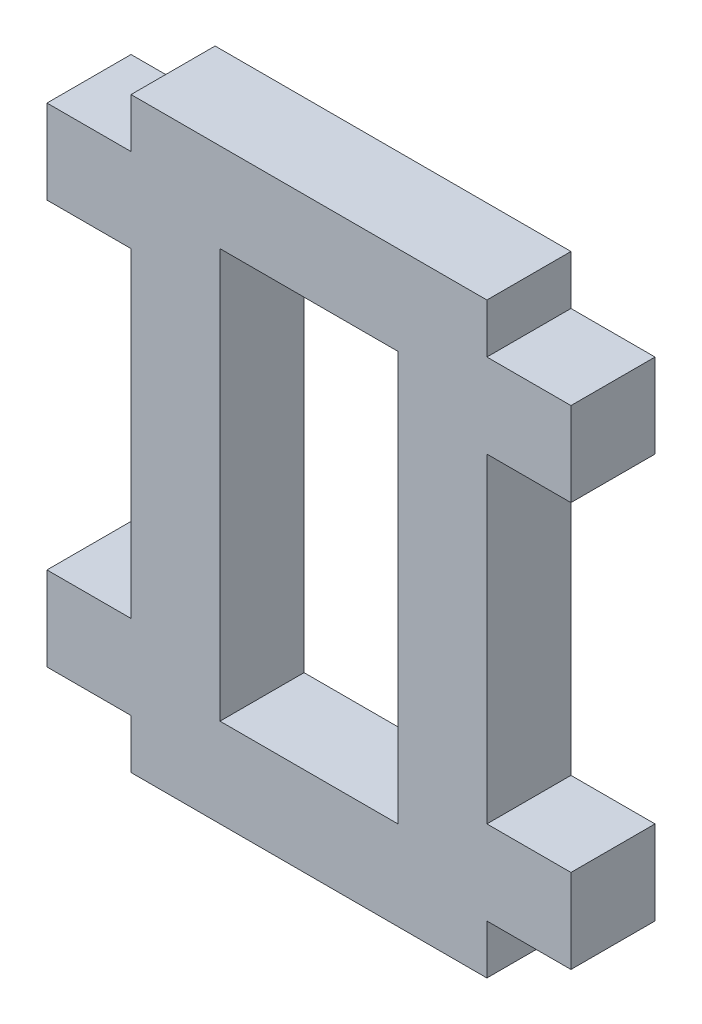
from build123d import *

# Parameters (mm, degrees)
SKETCH1_W           = 6
SKETCH1_H           = 6
SKETCH1_W_2         = 25.4
SKETCH1_H_2         = 41.91
BOSS_EXTRUDE1_DEPTH = 6
SKETCH2_W           = 12.7
SKETCH2_H           = 29.21
CUT_EXTRUDE1_DEPTH  = 29.719366724


with BuildPart() as part:
    # Sketch1 → Boss-Extrude1 (new body)
    with BuildSketch(Plane.XY):
        with Locations((-15.7, 14.43)):
            Rectangle(SKETCH1_W, SKETCH1_H)
        Rectangle(SKETCH1_W_2, SKETCH1_H_2)
        with Locations((-15.7, -14.43)):
            Rectangle(SKETCH1_W, SKETCH1_H)
        with Locations((15.7, -14.43)):
            Rectangle(SKETCH1_W, SKETCH1_H)
        with Locations((15.7, 14.43)):
            Rectangle(SKETCH1_W, SKETCH1_H)
    extrude(amount=BOSS_EXTRUDE1_DEPTH)

    # Sketch2 → Cut-Extrude1 (cut, through all)
    with BuildSketch(Plane.XY.offset(6)):
        Rectangle(SKETCH2_W, SKETCH2_H)
    extrude(amount=-CUT_EXTRUDE1_DEPTH, mode=Mode.SUBTRACT)


solid = part.part
